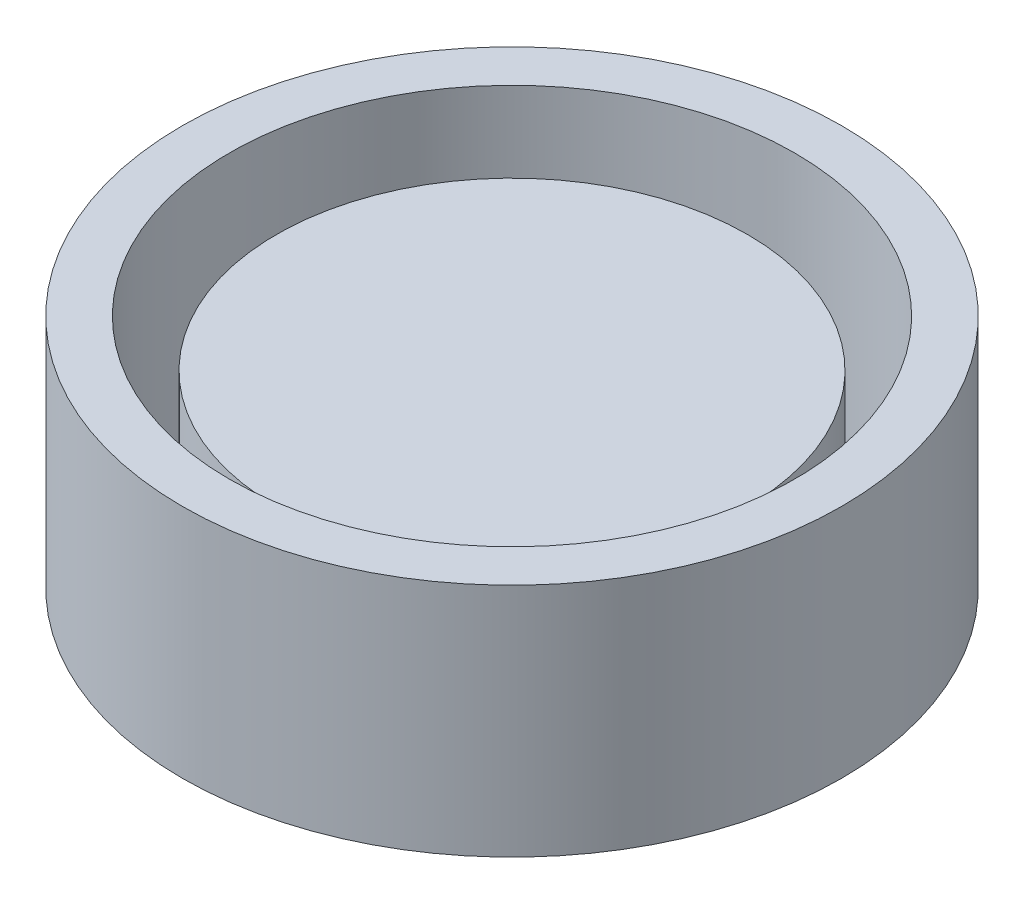
from build123d import *

# Parameters (mm, degrees)
BASE_R        = 5000
GROUND_DEPTH  = 4000
SKETCH1_3_R   = 7000
SKETCH1_3_R_2 = 6000
WALL_DEPTH    = 5000


with BuildPart() as part:
    # Base → Ground (new body)
    with BuildSketch(Plane(origin=(0, 0, 0), x_dir=(1, 0, 0), z_dir=(0, 1, 0))):
        Circle(BASE_R)
    extrude(amount=GROUND_DEPTH)


with BuildPart() as body_2:
    # Sketch1<3> → Wall (new body)
    with BuildSketch(Plane(origin=(0, 0, 0), x_dir=(1, 0, 0), z_dir=(0, 1, 0))):
        Circle(SKETCH1_3_R)
        Circle(SKETCH1_3_R_2, mode=Mode.SUBTRACT)
    extrude(amount=WALL_DEPTH)


solid = Compound([part.part, body_2.part])
